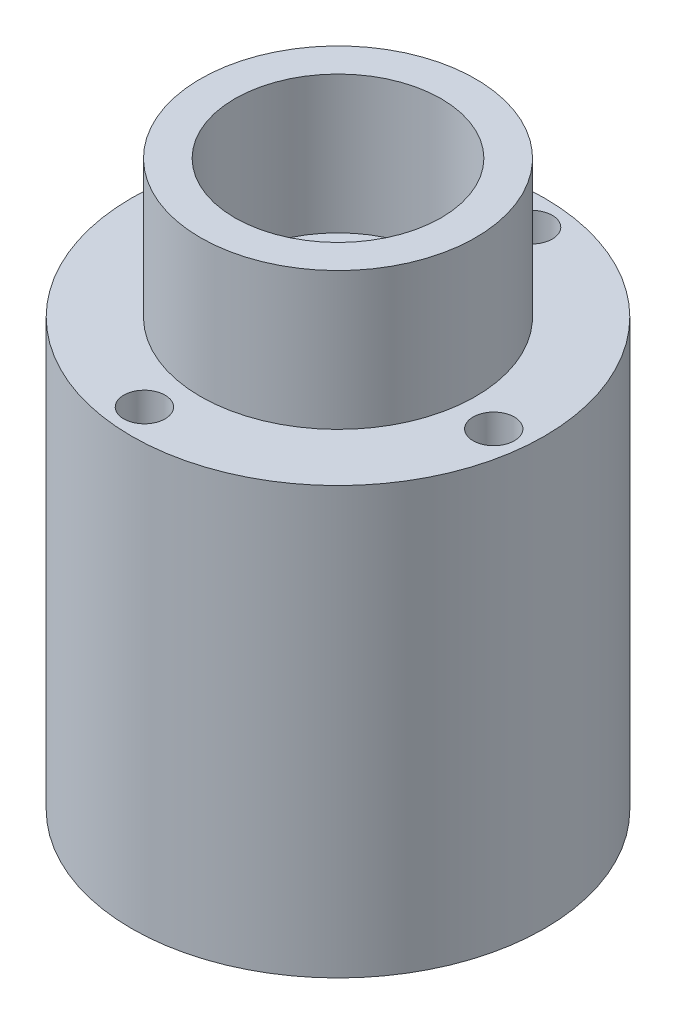
from build123d import *

# Parameters (mm, degrees)
SKETCH1_R           = 15
SKETCH1_R_2         = 1.5
BOSS_EXTRUDE1_DEPTH = 31
SKETCH2_R           = 10
SKETCH2_R_2         = 7.5
BOSS_EXTRUDE2_DEPTH = 10


with BuildPart() as part:
    # Sketch1 → Boss-Extrude1 (new body)
    with BuildSketch(Plane(origin=(0, 0, 0), x_dir=(1, 0, 0), z_dir=(0, 1, 0))):
        with Locations(Location((0, 0, 0), (0, 0, 270))):
            Circle(SKETCH1_R)
        with Locations(Location((-12.697691575, 1.377182715, 0), (0, 0, 270))):
            Circle(SKETCH1_R_2, mode=Mode.SUBTRACT)
        with Locations(Location((1.377182715, 12.697691575, 0), (0, 0, 270))):
            Circle(SKETCH1_R_2, mode=Mode.SUBTRACT)
        with Locations(Location((12.697691575, -1.377182715, 0), (0, 0, 270))):
            Circle(SKETCH1_R_2, mode=Mode.SUBTRACT)
        with Locations(Location((-1.377182715, -12.697691575, 0), (0, 0, 270))):
            Circle(SKETCH1_R_2, mode=Mode.SUBTRACT)
    extrude(amount=BOSS_EXTRUDE1_DEPTH)

    # Sketch2 → Boss-Extrude2 (add)
    with BuildSketch(Plane(origin=(0, 31, 0), x_dir=(1, 0, 0), z_dir=(0, 1, 0))):
        with Locations(Location((0, 0, 0), (0, 0, 270))):
            Circle(SKETCH2_R)
        with Locations(Location((0, 0, 0), (0, 0, 270))):
            Circle(SKETCH2_R_2, mode=Mode.SUBTRACT)
    extrude(amount=BOSS_EXTRUDE2_DEPTH)


solid = part.part
